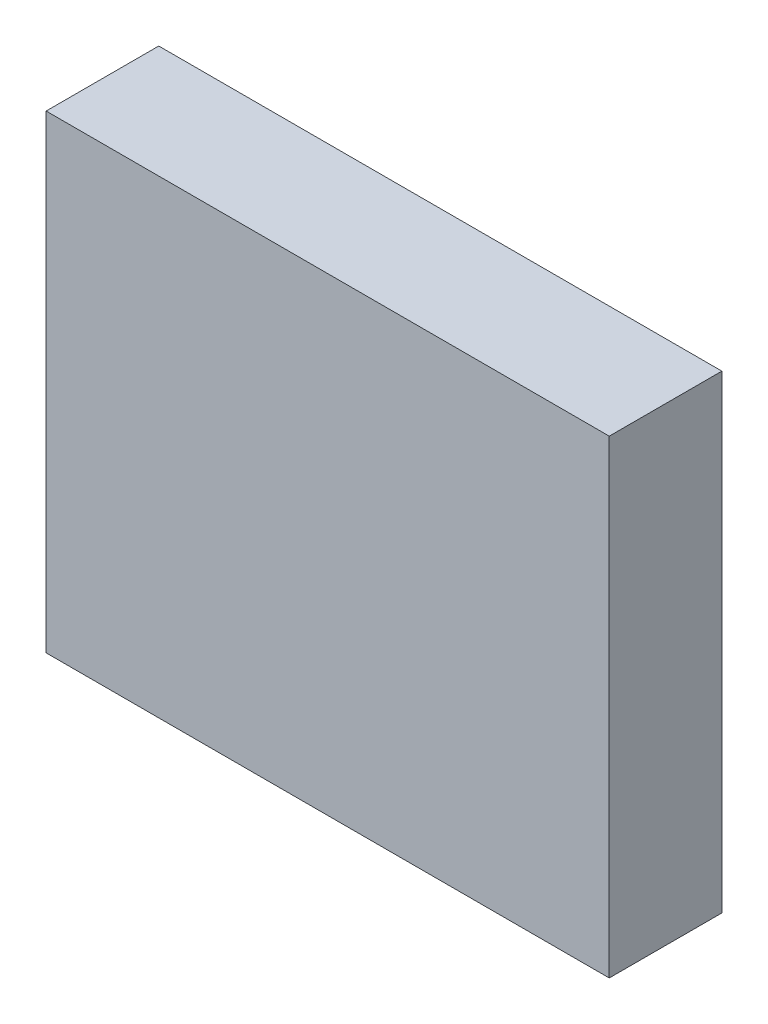
from build123d import *

# Parameters (mm, degrees)
STORE_SOG2_KONDENSER_1_START = -240
SKETCH1_W                    = 300
SKETCH1_H                    = 250
STORE_SOG2_KONDENSER_1_DEPTH = 60


with BuildPart() as part:
    # Sketch1 → STORE_sog2_kondenser_1 (new body)
    with BuildSketch(Plane.XY.offset(STORE_SOG2_KONDENSER_1_START)):
        with Locations((1090, 1805)):
            Rectangle(SKETCH1_W, SKETCH1_H)
    extrude(amount=-STORE_SOG2_KONDENSER_1_DEPTH)


solid = part.part
